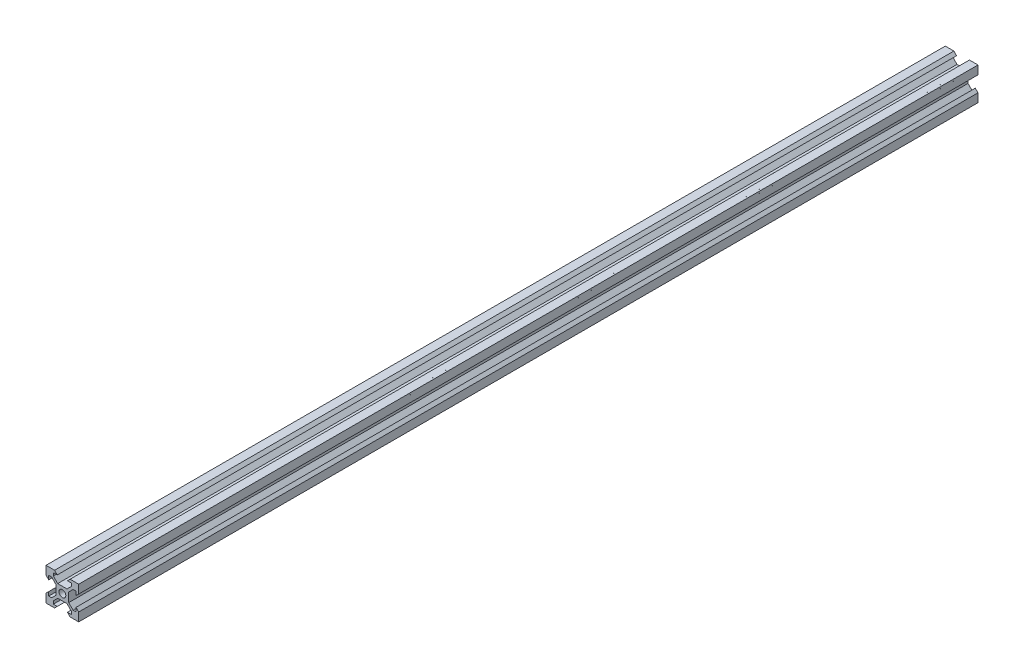
from build123d import *

# Parameters (mm, degrees)
SKETCH1_R           = 2.1
BOSS_EXTRUDE1_DEPTH = 550


with BuildPart() as part:
    # Sketch1 → Boss-Extrude1 (new body)
    with BuildSketch(Plane.XY):
        Polygon((2.834320347, 3.893970342), (5.5, 6.558849663), (5.5, 8.349069506), (3.1, 8.349069506), (4.75, 9.998574117), (10, 9.998574117), (10, 4.746997406), (8.35, 3.097492795), (8.350720674, 5.497492687), (6.560500912, 5.498030255), (3.894821259, 2.833150935), (3.894821259, -2.833150935), (6.560500912, -5.498030255), (8.350720674, -5.497492687), (8.35, -3.097492795), (10, -4.746997406), (10, -9.998574117), (4.75, -9.998574117), (3.1, -8.349069506), (5.5, -8.349069506), (5.5, -6.558849663), (2.834320347, -3.893970342), (-2.834320347, -3.893970342), (-5.5, -6.558849663), (-5.5, -8.349069506), (-3.1, -8.349069506), (-4.75, -9.998574117), (-10, -9.998574117), (-10, -4.746997406), (-8.35, -3.097492795), (-8.350720674, -5.497492687), (-6.560500912, -5.498030255), (-3.894821259, -2.833150935), (-3.894821259, 2.833150935), (-6.560500912, 5.498030255), (-8.350720674, 5.497492687), (-8.35, 3.097492795), (-10, 4.746997406), (-10, 9.998574117), (-4.75, 9.998574117), (-3.1, 8.349069506), (-5.5, 8.349069506), (-5.5, 6.558849663), (-2.834320347, 3.893970342), align=None)
        Circle(SKETCH1_R, mode=Mode.SUBTRACT)
    extrude(amount=BOSS_EXTRUDE1_DEPTH)


solid = part.part
